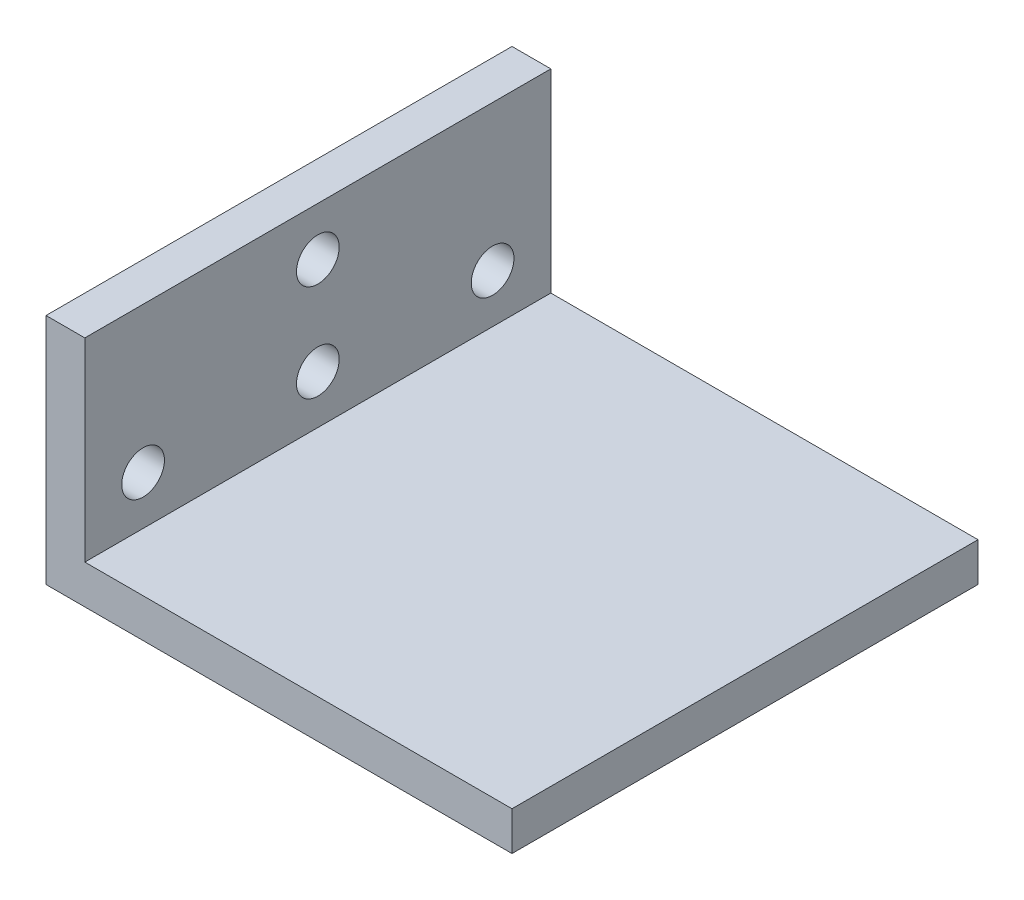
from build123d import *

# Parameters (mm, degrees)
SKETCH7_R          = 6.985
CUT_EXTRUDE4_DEPTH = 12.7


with BuildPart() as part:
    # Sweep1: sweep along a path in Sketch2
    with BuildLine(Plane(origin=(0, 0, 0), x_dir=(1, 0, 0), z_dir=(0, 1, 0))) as sweep1_path:
        Line((0, 0), (0, -152.4))
    # Sketch1 → Sweep1 (sweep)
    with BuildSketch(Plane.XY):
        Polygon((0, 0), (0, 76.2), (12.7, 76.2), (12.7, 12.7), (152.4, 12.7), (152.4, 0), align=None)
    sweep(path=sweep1_path.line)

    # Sketch7 → Cut-Extrude4 (cut)
    with BuildSketch(Plane(origin=(12.7, 0, 0), x_dir=(0, 0, -1), z_dir=(1, 0, 0))):
        with Locations((-133.35, 28.575)):
            Circle(SKETCH7_R)
        with Locations((-19.05, 28.575)):
            Circle(SKETCH7_R)
        with Locations((-76.2, 60.325)):
            Circle(SKETCH7_R)
        with Locations((-76.2, 28.575)):
            Circle(SKETCH7_R)
    extrude(amount=-CUT_EXTRUDE4_DEPTH, mode=Mode.SUBTRACT)


solid = part.part
